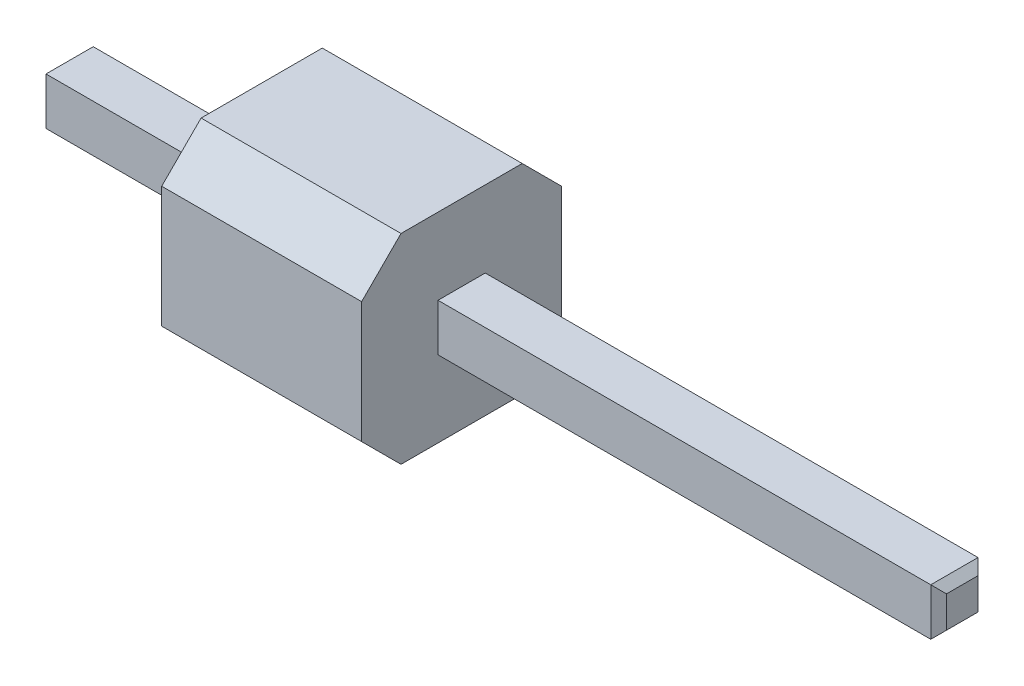
from build123d import *

# Parameters (mm, degrees)
PLASTIC_DEPTH = 2.54
SKETCH2_W     = 11.44
SKETCH2_H     = 0.6
CONTACT_DEPTH = 0.3
CHAMFER1_SIZE = 0.1


with BuildPart() as part:
    # Sketch1 → Plastic (new body)
    with BuildSketch(Plane(origin=(0, 0, 0), x_dir=(0, 0, -1), z_dir=(1, 0, 0))):
        Polygon((-2.04, 1.27), (-0.5, 1.27), (0, 0.77), (0, -0.77), (-0.5, -1.27), (-2.04, -1.27), (-2.54, -0.77), (-2.54, 0.77), align=None)
    extrude(amount=PLASTIC_DEPTH)

    # Sketch2 → Contact (add, symmetric)
    with BuildSketch(Plane(origin=(0, 0, 0), x_dir=(1, 0, 0), z_dir=(0, 1, 0))):
        with Locations((3.18, -1.27)):
            Rectangle(SKETCH2_W, SKETCH2_H)
    extrude(amount=CONTACT_DEPTH, both=True)

    # Chamfer1
    chamfer1_edges = [part.edges().sort_by_distance(p)[0] for p in [
        (8.9, 0, 0.97),
        (8.9, 0.3, 1.27),
        (-2.54, 0, 1.57),
        (8.9, -0.3, 1.27),
        (8.9, 0, 1.57),
        (-2.54, -0.3, 1.27),
        (-2.54, 0, 0.97),
        (-2.54, 0.3, 1.27),
    ]]
    chamfer(chamfer1_edges, length=CHAMFER1_SIZE)


solid = part.part
